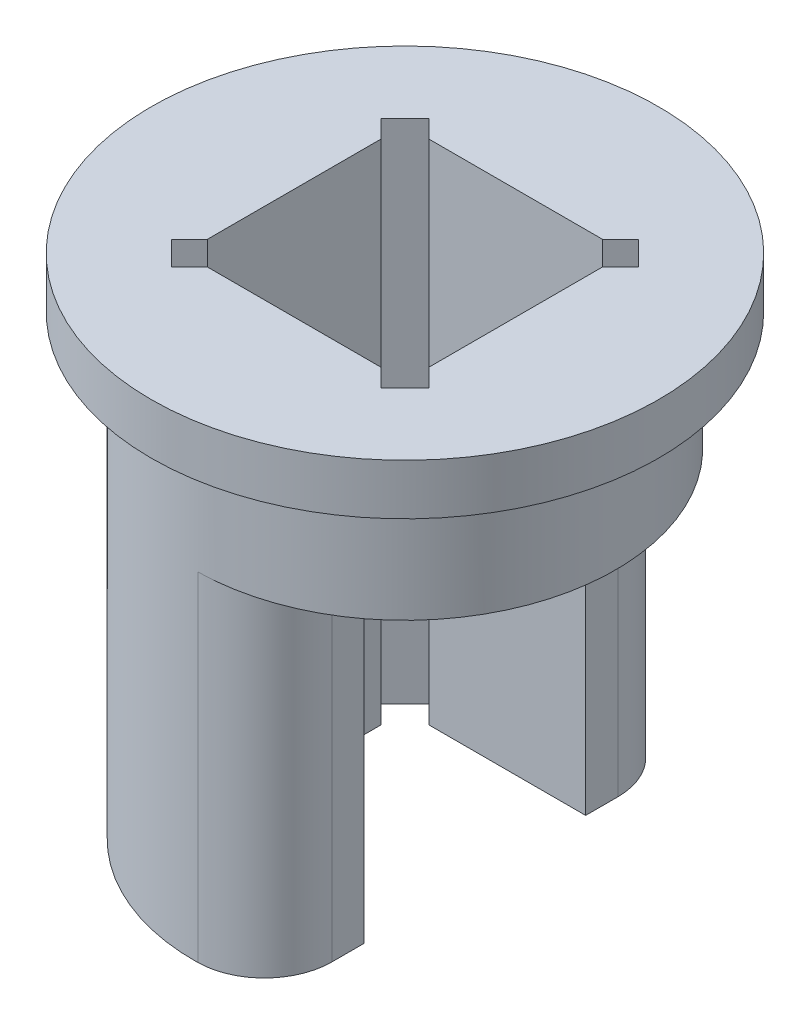
from build123d import *

# Parameters (mm, degrees)
SKETCH1_R           = 12.45
BOSS_EXTRUDE3_DEPTH = 30
BOSS_EXTRUDE4_START = -3
SKETCH4_R           = 15
SKETCH4_R_2         = 12.45
BOSS_EXTRUDE4_DEPTH = 3
CUT_EXTRUDE1_DEPTH  = 20
FILLET1_R           = 4


with BuildPart() as part:
    # Sketch1 → Boss-Extrude3 (new body)
    with BuildSketch(Plane(origin=(0, 0, 0), x_dir=(1, 0, 0), z_dir=(0, 1, 0))):
        with Locations(Location((0, 0, 0), (0, 0, 270))):
            Circle(SKETCH1_R)
        Polygon((6.196446609, 7.610660172), (7.610660172, 6.196446609), (6.55, 5.135786438), (6.55, -5.135786438), (7.610660172, -6.196446609), (6.196446609, -7.610660172), (5.135786438, -6.55), (-5.135786438, -6.55), (-6.196446609, -7.610660172), (-7.610660172, -6.196446609), (-6.55, -5.135786438), (-6.55, 5.135786438), (-7.610660172, 6.196446609), (-6.196446609, 7.610660172), (-5.135786438, 6.55), (5.135786438, 6.55), align=None, mode=Mode.SUBTRACT)
    extrude(amount=BOSS_EXTRUDE3_DEPTH)

    # Sketch4 → Boss-Extrude4 (add)
    with BuildSketch(Plane(origin=(0, 30, 0), x_dir=(1, 0, 0), z_dir=(0, 1, 0)).offset(BOSS_EXTRUDE4_START)):
        with Locations(Location((0, 0, 0), (0, 0, 270))):
            Circle(SKETCH4_R)
        with Locations(Location((0, 0, 0), (0, 0, 270))):
            Circle(SKETCH4_R_2, mode=Mode.SUBTRACT)
    extrude(amount=BOSS_EXTRUDE4_DEPTH)

    # Sketch5 → Cut-Extrude1 (cut)
    with BuildSketch(Plane.XZ):
        with BuildLine():
            Line((4.135786438, -11.742988144), (4.135786438, 11.742988144))
            ThreePointArc((4.135786438, 11.742988144), (12.45, 0), (4.135786438, -11.742988144))
        make_face()
    extrude(amount=-CUT_EXTRUDE1_DEPTH, mode=Mode.SUBTRACT)

    # Fillet1
    fillet1_edges = [part.edges().sort_by_distance(p)[0] for p in [
        (4.135786438, 10, -11.742988144),
        (4.135786438, 10, 11.742988144),
    ]]
    fillet(fillet1_edges, radius=FILLET1_R)


solid = part.part
